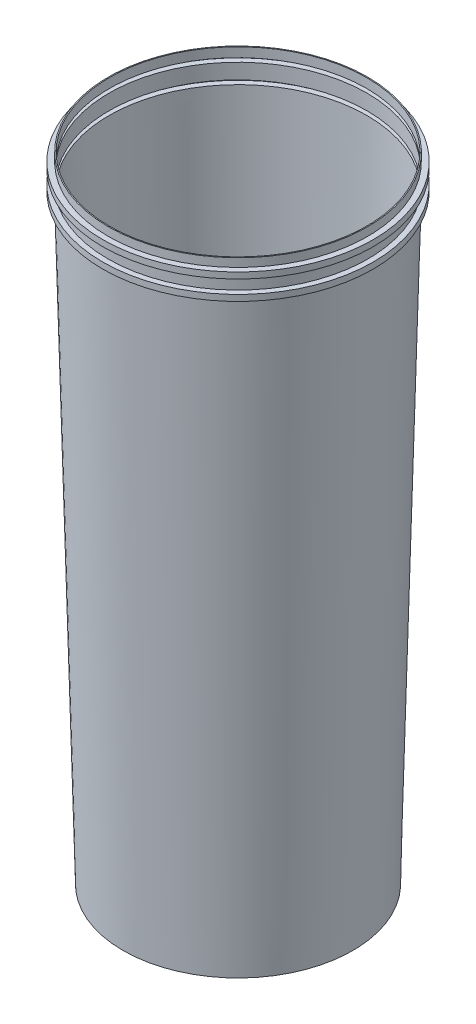
from build123d import *

# Parameters (mm, degrees)
SHELL5_T         = 1
SWEEP1_PROFILE_R = 2.5


with BuildPart() as part:
    # Sketch1 → Revolve1 (revolve)
    with BuildSketch(Plane.XY, mode=Mode.PRIVATE) as revolve1_sk:
        Polygon((0, 620), (-126, 620), (-126, 610.763571771), (-131.422468228, 610.763571771), (-131.422468228, 606.763571771), (-126.257555316, 606.763571771), (-126.257555316, 591.763571771), (-131.422468228, 591.763571771), (-131.422468228, 587.763571771), (-126.257555316, 587.763571771), (-111.609923626, 0), (0, 0), align=None)
    revolve(revolve1_sk.sketch.rotate(Axis((0, 0, 0), (0, 1, 0)), 270), axis=Axis((0, 0, 0), (0, 1, 0)))

    # Shell5
    shell5_openings = [part.faces().sort_by_distance(p)[0] for p in [
        (0, 620, 0),
    ]]
    offset(amount=SHELL5_T, openings=shell5_openings, kind=Kind.INTERSECTION)

    # Sweep1: sweep along a path in Sketch4
    with BuildLine(Plane(origin=(0, 0, 0), x_dir=(1, 0, 0), z_dir=(0, 0, -1))) as sweep1_path:
        Line((-14.999820713, 0), (-14.999820713, -280.07351805))
        ThreePointArc((-14.999820713, -280.07351805), (0, -295.073338764), (14.999820713, -280.07351805))
        Line((14.999820713, -280.07351805), (14.999820713, -0.073338764))
    # Sweep1 profile (on start of the path) → Sweep1 (sweep)
    with BuildSketch(Plane(origin=(-14.999820713, 0, 0), x_dir=(1, 0, 0), z_dir=(0, 1, 0))):
        Circle(SWEEP1_PROFILE_R)
    sweep(path=sweep1_path.line)


solid = part.part
